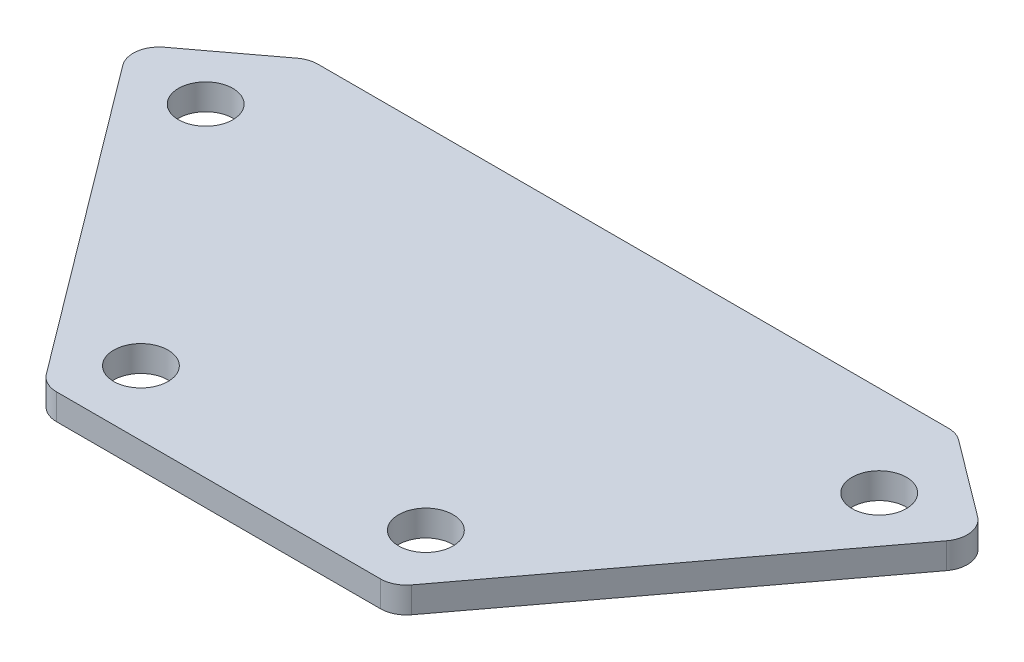
from build123d import *

# Parameters (mm, degrees)
SKETCH_1_R      = 2.1
EXTRUDE_2_DEPTH = 2
FILLET_1_R      = 2


with BuildPart() as part:
    # ｽｹｯﾁ1 → ﾎﾞｽ - 押し出し2 (new body)
    with BuildSketch(Plane(origin=(0, 0, 0), x_dir=(1, 0, 0), z_dir=(0, 1, 0))):
        Polygon((36, 27), (-14, 27), (-22, 21), (-2.5, -5), (1.666666667, -5), (20, -5), (24.5, -5), (44, 21), align=None)
        with Locations(Location((0, 0, 0), (0, 0, 270))):
            Circle(SKETCH_1_R, mode=Mode.SUBTRACT)
        with BuildLine():
            ThreePointArc((20, -0.640312424), (19.9, 0), (20, 0.640312424))
            ThreePointArc((20, 0.640312424), (24.1, 0), (20, -0.640312424))
        make_face(mode=Mode.SUBTRACT)
        with Locations(Location((-15, 20, 0), (0, 0, 270))):
            Circle(SKETCH_1_R, mode=Mode.SUBTRACT)
        with Locations(Location((37, 20, 0), (0, 0, 270))):
            Circle(SKETCH_1_R, mode=Mode.SUBTRACT)
    extrude(amount=EXTRUDE_2_DEPTH)

    # ﾌｨﾚｯﾄ1
    fillet_1_edges = [part.edges().sort_by_distance(p)[0] for p in [
        (-22, 1, -21),
        (-14, 1, -27),
        (36, 1, -27),
        (44, 1, -21),
        (24.5, 1, 5),
        (-2.5, 1, 5),
    ]]
    fillet(fillet_1_edges, radius=FILLET_1_R)


solid = part.part
